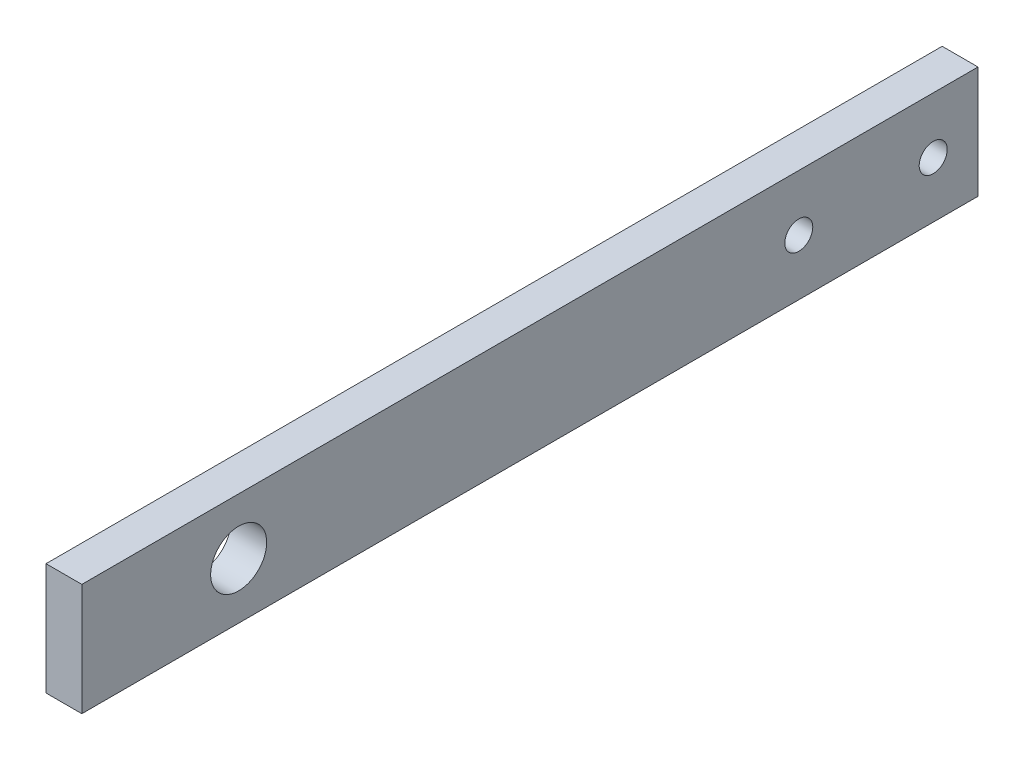
from build123d import *

# Parameters (mm, degrees)
SKETCH1_W                          = 50.8
SKETCH1_H                          = 6.35
BOSS_EXTRUDE1_DEPTH                = 2.032
F_1_16_0_0625_DIAMETER_HOLE1_D     = 1.5875
F_1_16_0_0625_DIAMETER_HOLE1_DEPTH = 70.104
F_1_16_0_0625_DIAMETER_HOLE1_TIP   = 0.476933116
F_1_8_0_125_DIAMETER_HOLE1_D       = 3.175
F_1_8_0_125_DIAMETER_HOLE1_DEPTH   = 70.104
F_1_8_0_125_DIAMETER_HOLE1_TIP     = 0.953866233


with BuildPart() as part:
    # Sketch1 → Boss-Extrude1 (new body)
    with BuildSketch(Plane(origin=(0, 0, 0), x_dir=(0, 0, -1), z_dir=(1, 0, 0))):
        with Locations((25.4, 3.175)):
            Rectangle(SKETCH1_W, SKETCH1_H)
    extrude(amount=BOSS_EXTRUDE1_DEPTH)

    # 1/16 (0.0625) Diameter Hole1
    with Locations(Plane(origin=(2.032, 0, 0), x_dir=(0, 0, -1), z_dir=(1, 0, 0))):
        with Locations((40.64, 3.175), (48.26, 3.175)):
            Hole(F_1_16_0_0625_DIAMETER_HOLE1_D / 2, depth=F_1_16_0_0625_DIAMETER_HOLE1_DEPTH)
            with Locations((0, 0, -(F_1_16_0_0625_DIAMETER_HOLE1_DEPTH + F_1_16_0_0625_DIAMETER_HOLE1_TIP / 2))):  # 118° drill point
                Cone(0, F_1_16_0_0625_DIAMETER_HOLE1_D / 2, F_1_16_0_0625_DIAMETER_HOLE1_TIP, mode=Mode.SUBTRACT)

    # 1/8 (0.125) Diameter Hole1
    with Locations(Plane(origin=(2.032, 0, 0), x_dir=(0, 0, -1), z_dir=(1, 0, 0))):
        with Locations((8.89, 3.175)):
            Hole(F_1_8_0_125_DIAMETER_HOLE1_D / 2, depth=F_1_8_0_125_DIAMETER_HOLE1_DEPTH)
            with Locations((0, 0, -(F_1_8_0_125_DIAMETER_HOLE1_DEPTH + F_1_8_0_125_DIAMETER_HOLE1_TIP / 2))):  # 118° drill point
                Cone(0, F_1_8_0_125_DIAMETER_HOLE1_D / 2, F_1_8_0_125_DIAMETER_HOLE1_TIP, mode=Mode.SUBTRACT)


solid = part.part
